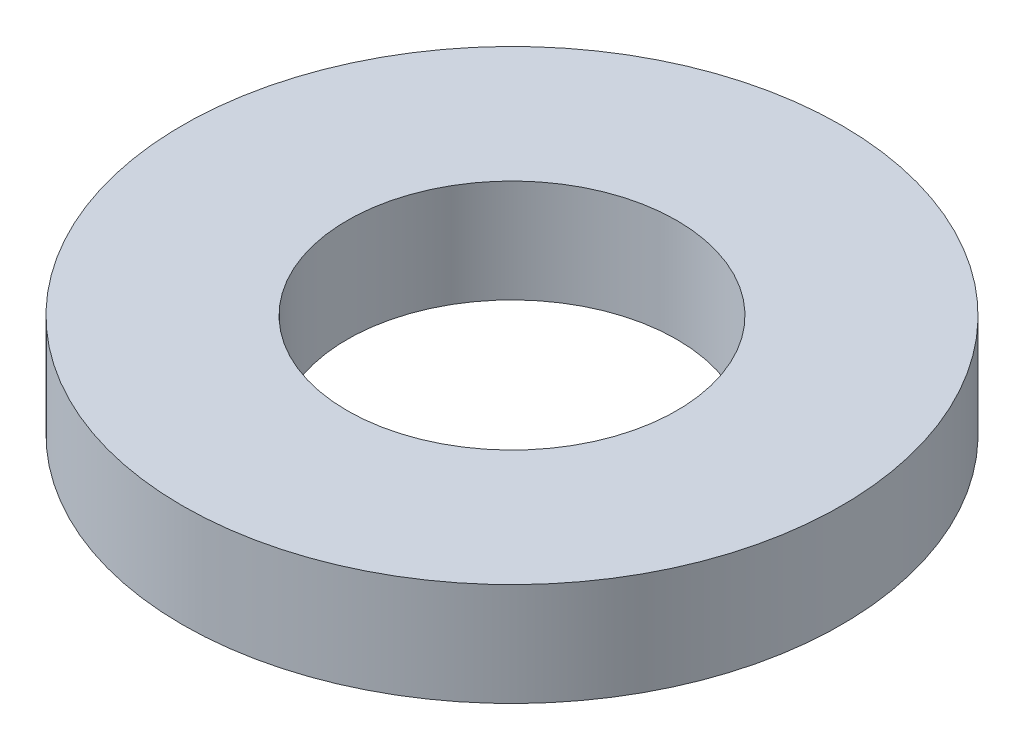
from build123d import *

# Parameters (mm, degrees)
SKETCH1_R           = 8
SKETCH1_R_2         = 4
BOSS_EXTRUDE1_DEPTH = 2.5


with BuildPart() as part:
    # Sketch1 → Boss-Extrude1 (new body)
    with BuildSketch(Plane(origin=(0, 0, 0), x_dir=(1, 0, 0), z_dir=(0, 1, 0))):
        with Locations(Location((0, 0, 0), (0, 0, 270))):
            Circle(SKETCH1_R)
        with Locations(Location((0, 0, 0), (0, 0, 270))):
            Circle(SKETCH1_R_2, mode=Mode.SUBTRACT)
    extrude(amount=BOSS_EXTRUDE1_DEPTH)


solid = part.part
